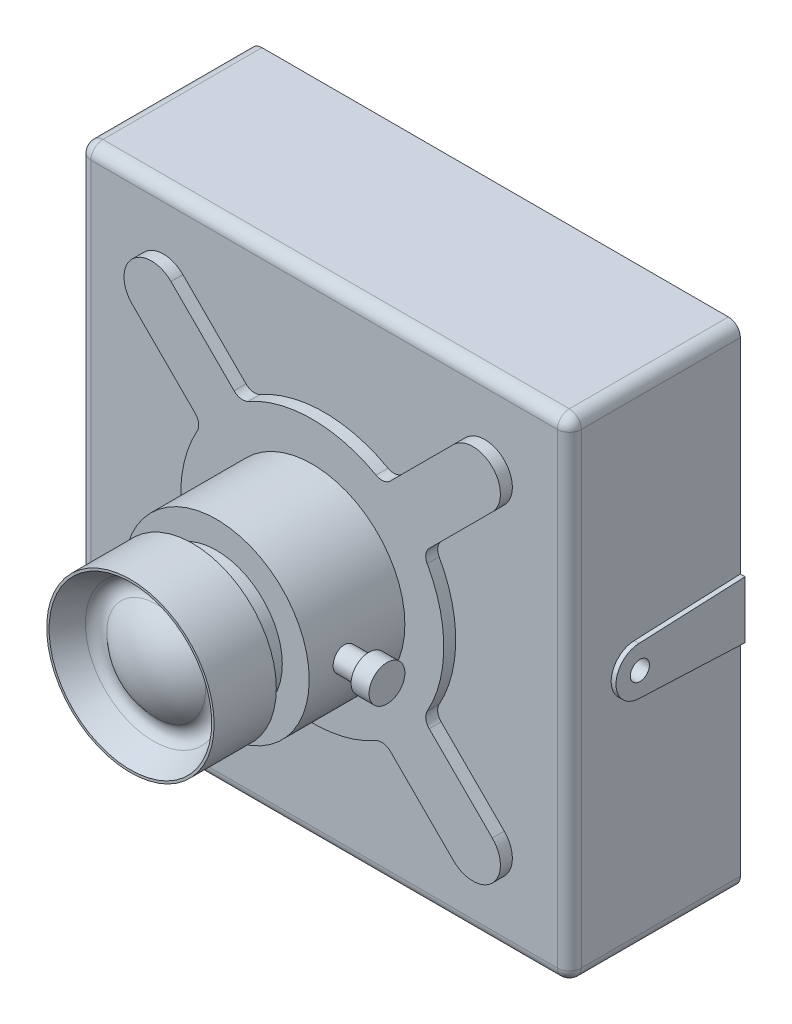
from build123d import *

# Parameters (mm, degrees)
SKETCH_2_W                       = 41
SKETCH_2_H                       = 41
EXTRUDE_1_DEPTH                  = 14.3
EXTRUDE_2_DEPTH                  = 1
SKETCH_4_R                       = 7.75
EXTRUDE_3_DEPTH                  = 8
SKETCH_5_R                       = 5.5
EXTRUDE_4_DEPTH                  = 2
SKETCH_6_R                       = 7
EXTRUDE_5_DEPTH                  = 5.2
FILLET_1_R                       = 1
EXTRUDE_6_DEPTH                  = 0.4
SKETCH_11_W                      = 11.5
SKETCH_11_H                      = 6
CUT_EXTRUDE_1_DEPTH              = 7
SKETCH_12_W                      = 11
SKETCH_12_H                      = 4.8
EXTRUDE_7_DEPTH                  = 8.5
SKETCH_13_R                      = 0.5
EXTRUDE_8_DEPTH                  = 3
SKETCH_14_R                      = 1
EXTRUDE_9_DEPTH                  = 2
EXTRUDE_9_DIRECTION_2_REACH      = 48.597
EXTRUDE_9_DIRECTION_2_END_RADIUS = 7.75
SKETCH_15_R                      = 1.5
EXTRUDE_10_DEPTH                 = 1.5


with BuildPart() as part:
    # 草图2 → 凸台-拉伸1 (new body)
    with BuildSketch(Plane.XY):
        Rectangle(SKETCH_2_W, SKETCH_2_H)
    extrude(amount=EXTRUDE_1_DEPTH)

    # 草图3 → 凸台-拉伸2 (add)
    with BuildSketch(Plane.XY.offset(14.3)):
        with BuildLine():
            Line((-11.808683246, 15.061374439), (-6.531779188, 9.784470381))
            ThreePointArc((-6.531779188, 9.784470381), (-5.963517237, 9.501263014), (-5.339283039, 9.617279066))
            ThreePointArc((-5.339283039, 9.617279066), (0, 11), (5.339283039, 9.617279066))
            ThreePointArc((5.339283039, 9.617279066), (5.963517237, 9.501263014), (6.531779188, 9.784470381))
            Line((6.531779188, 9.784470381), (11.808683246, 15.061374439))
            ThreePointArc((11.808683246, 15.061374439), (15.061374439, 15.061374439), (15.061374439, 11.808683246))
            Line((15.061374439, 11.808683246), (9.784470381, 6.531779188))
            ThreePointArc((9.784470381, 6.531779188), (9.501263014, 5.963517237), (9.617279066, 5.339283039))
            ThreePointArc((9.617279066, 5.339283039), (11, 0), (9.617279066, -5.339283039))
            ThreePointArc((9.617279066, -5.339283039), (9.501263014, -5.963517237), (9.784470381, -6.531779188))
            Line((9.784470381, -6.531779188), (15.061374439, -11.808683246))
            ThreePointArc((15.061374439, -11.808683246), (15.061374439, -15.061374439), (11.808683246, -15.061374439))
            Line((11.808683246, -15.061374439), (6.531779188, -9.784470381))
            ThreePointArc((6.531779188, -9.784470381), (5.963517237, -9.501263014), (5.339283039, -9.617279066))
            ThreePointArc((5.339283039, -9.617279066), (0, -11), (-5.339283039, -9.617279066))
            ThreePointArc((-5.339283039, -9.617279066), (-5.963517237, -9.501263014), (-6.531779188, -9.784470381))
            Line((-6.531779188, -9.784470381), (-11.808683246, -15.061374439))
            ThreePointArc((-11.808683246, -15.061374439), (-15.061374439, -15.061374439), (-15.061374439, -11.808683246))
            Line((-15.061374439, -11.808683246), (-9.784470381, -6.531779188))
            ThreePointArc((-9.784470381, -6.531779188), (-9.501263014, -5.963517237), (-9.617279066, -5.339283039))
            ThreePointArc((-9.617279066, -5.339283039), (-11, 0), (-9.617279066, 5.339283039))
            ThreePointArc((-9.617279066, 5.339283039), (-9.501263014, 5.963517237), (-9.784470381, 6.531779188))
            Line((-9.784470381, 6.531779188), (-15.061374439, 11.808683246))
            ThreePointArc((-15.061374439, 11.808683246), (-15.061374439, 15.061374439), (-11.808683246, 15.061374439))
        make_face()
    extrude(amount=EXTRUDE_2_DEPTH)

    # 草图4 → 凸台-拉伸3 (add)
    with BuildSketch(Plane.XY.offset(15.3)):
        Circle(SKETCH_4_R)
    extrude(amount=EXTRUDE_3_DEPTH)

    # 草图5 → 凸台-拉伸4 (add)
    with BuildSketch(Plane.XY.offset(23.3)):
        Circle(SKETCH_5_R)
    extrude(amount=EXTRUDE_4_DEPTH)

    # 草图6 → 凸台-拉伸5 (add)
    with BuildSketch(Plane.XY.offset(25.3)):
        Circle(SKETCH_6_R)
    extrude(amount=EXTRUDE_5_DEPTH)

    # 草图7 → 切除-旋转3 (revolve, cut)
    with BuildSketch(Plane(origin=(0, 0, 0), x_dir=(1, 0, 0), z_dir=(0, 1, 0)), mode=Mode.PRIVATE) as cut_revolve_3_sk:
        with BuildLine():
            Line((-6.8, -30.5), (-5.688128428, -28.574181946))
            ThreePointArc((-5.688128428, -28.574181946), (-4.965242644, -28.084479441), (-4.133231164, -28.349298811))
            ThreePointArc((-4.133231164, -28.349298811), (-2.225332237, -29.572063929), (0, -30))
            Line((0, -30), (0, -30.5))
            Line((0, -30.5), (-6.8, -30.5))
        make_face()
    revolve(cut_revolve_3_sk.sketch.rotate(Axis((0, 0, 30.5), (0, 0, -1)), 180), axis=Axis((0, 0, 30.5), (0, 0, -1)), mode=Mode.SUBTRACT)

    # 圆角1
    fillet_1_edges = [part.edges().sort_by_distance(p)[0] for p in [
        (-20.5, 0, 14.3),
        (0, -20.5, 14.3),
        (20.5, 0, 14.3),
        (0, 20.5, 14.3),
        (20.5, -20.5, 7.15),
        (-20.5, -20.5, 7.15),
        (-20.5, 20.5, 7.15),
        (20.5, 20.5, 7.15),
    ]]
    fillet(fillet_1_edges, radius=FILLET_1_R)

    # 草图8 → 凸台-拉伸6 (add)
    with BuildSketch(Plane(origin=(20.5, 0, 0), x_dir=(0, 0, -1), z_dir=(1, 0, 0))):
        with BuildLine():
            Line((-8.887238775, 1.998096443), (0, 2.386121668))
            Line((0, 2.386121668), (0, -2.386121668))
            Line((0, -2.386121668), (-8.887238775, -1.998096443))
            ThreePointArc((-8.887238775, -1.998096443), (-10.8, 0), (-8.887238775, 1.998096443))
        make_face()
    extrude_6 = extrude(amount=EXTRUDE_6_DEPTH)

    # 草图10 → M2 螺纹孔1 (revolve, cut)
    with BuildSketch(Plane(origin=(20.9, 0, 8.8), x_dir=(0, 0, -1), z_dir=(0, 1, 0))):
        Polygon((0, 0), (0, 5.680688495), (0.8, 5.2), (0.8, 0), align=None)
    hole_wizard_m2_1 = revolve(axis=Axis((27.25, 0, 8.8), (-1, 0, 0)), mode=Mode.SUBTRACT)

    # 镜向1: 凸台-拉伸6, M2 螺纹孔1 across plane
    add(extrude_6.mirror(Plane(origin=(0, 0, 0), x_dir=(0, 0, 1), z_dir=(1, 0, 0))))
    add(hole_wizard_m2_1.mirror(Plane(origin=(0, 0, 0), x_dir=(0, 0, 1), z_dir=(1, 0, 0))), mode=Mode.SUBTRACT)

    # 草图11 → 切除-拉伸1 (cut)
    with BuildSketch(Plane(origin=(0, 0, 0), x_dir=(-1, 0, 0), z_dir=(0, 0, -1))):
        with Locations((-4.75, -14)):
            Rectangle(SKETCH_11_W, SKETCH_11_H)
    extrude(amount=-CUT_EXTRUDE_1_DEPTH, mode=Mode.SUBTRACT)

    # 草图12 → 凸台-拉伸7 (add)
    with BuildSketch(Plane(origin=(0, 0, 7), x_dir=(-1, 0, 0), z_dir=(0, 0, -1))):
        with Locations((-4.75, -13.6)):
            Rectangle(SKETCH_12_W, SKETCH_12_H)
    extrude(amount=EXTRUDE_7_DEPTH)

    # 草图13 → 凸台-拉伸8 (add)
    with BuildSketch(Plane(origin=(0, 0, -1.5), x_dir=(-1, 0, 0), z_dir=(0, 0, -1))):
        with Locations((-8.56, -14)):
            Circle(SKETCH_13_R)
        with Locations((-6.02, -14)):
            Circle(SKETCH_13_R)
        with Locations((-3.48, -14)):
            Circle(SKETCH_13_R)
        with Locations((-0.94, -14)):
            Circle(SKETCH_13_R)
    extrude(amount=EXTRUDE_8_DEPTH)

    # 草图14 → 凸台-拉伸9 (add)
    with BuildSketch(Plane(origin=(7.75, 0, 0), x_dir=(0, 0, -1), z_dir=(1, 0, 0))):
        with Locations((-20.3, 0)):
            Circle(SKETCH_14_R)
    extrude(amount=EXTRUDE_9_DEPTH)

    # 凸台-拉伸9 direction 2: up to this cylinder (the profile starts outside it)
    extrude_9_direction_2_end = Plane(origin=(0, 0, 20.3), z_dir=(0, 0, -1)) * Cylinder(EXTRUDE_9_DIRECTION_2_END_RADIUS, 113.694, mode=Mode.PRIVATE)
    # 草图14 → 凸台-拉伸9 direction 2 (add, up to the surface)
    with BuildSketch(Plane(origin=(7.75, 0, 0), x_dir=(0, 0, -1), z_dir=(1, 0, 0)), mode=Mode.PRIVATE) as extrude_9_direction_2_sk1:
        with Locations((-20.3, 0)):
            Circle(SKETCH_14_R)
    extrude_9_direction_2_tool1 = extrude(extrude_9_direction_2_sk1.sketch, amount=-EXTRUDE_9_DIRECTION_2_REACH, mode=Mode.PRIVATE) - extrude_9_direction_2_end
    add(extrude_9_direction_2_tool1.solids().sort_by_distance((7.75, 0, 20.3))[0])
    add(extrude_9_direction_2_tool1.solids().sort_by_distance((7.75, 0, 20.3))[1])

    # 草图15 → 凸台-拉伸10 (add)
    with BuildSketch(Plane(origin=(9.75, 0, 0), x_dir=(0, 0, -1), z_dir=(1, 0, 0))):
        with Locations((-20.3, 0)):
            Circle(SKETCH_15_R)
    extrude(amount=EXTRUDE_10_DEPTH)


solid = part.part
